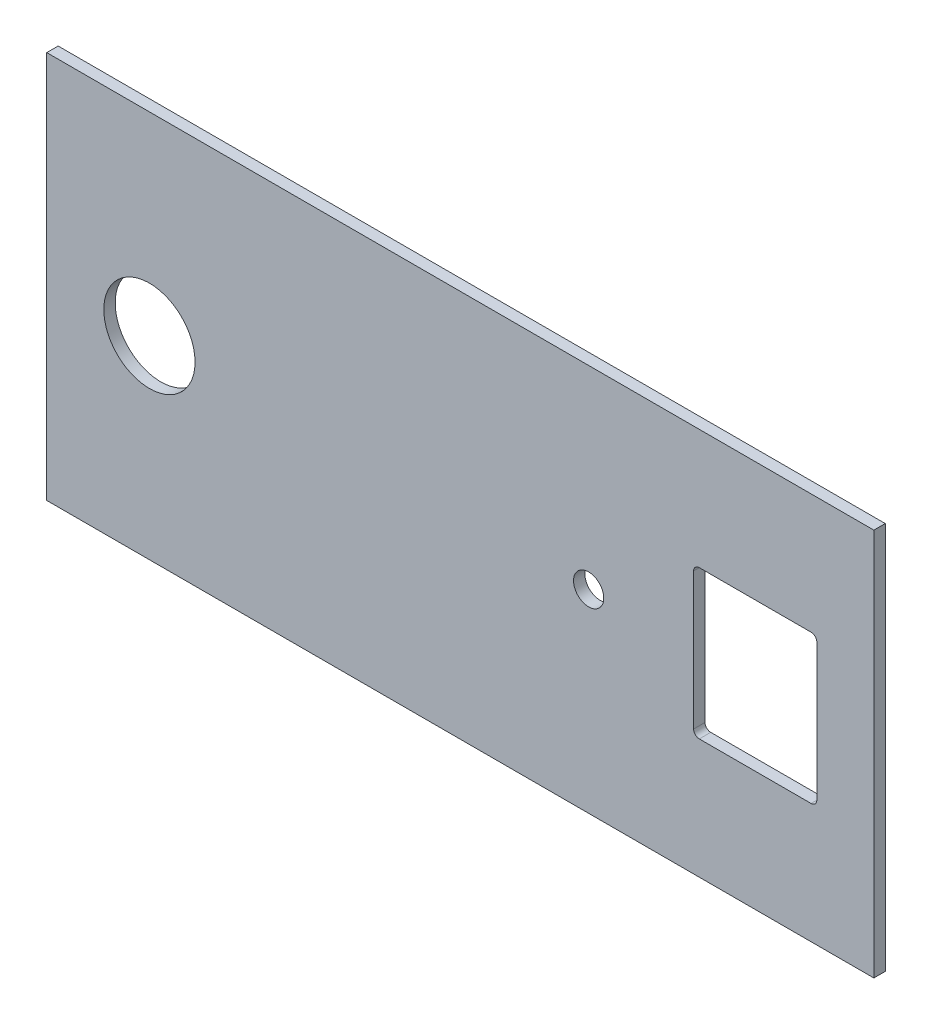
from build123d import *

# Parameters (mm, degrees)
SKETCH1_W           = 145
SKETCH1_H           = 68
BOSS_EXTRUDE1_DEPTH = 2
SKETCH2_R           = 8
SKETCH2_R_2         = 2.65
CUT_EXTRUDE1_DEPTH  = 81.101498113


with BuildPart() as part:
    # Sketch1 → Boss-Extrude1 (new body)
    with BuildSketch(Plane.XY):
        Rectangle(SKETCH1_W, SKETCH1_H)
    extrude(amount=BOSS_EXTRUDE1_DEPTH)

    # Sketch2 → Cut-Extrude1 (cut, through all)
    with BuildSketch(Plane.XY.offset(2)):
        with Locations((-54.5, 0)):
            Circle(SKETCH2_R)
        with Locations((22.5, 0)):
            Circle(SKETCH2_R_2)
        with BuildLine():
            Line((61.5, -13), (41.9, -13))
            ThreePointArc((41.9, -13), (41.192893219, -12.707106781), (40.9, -12))
            Line((40.9, -12), (40.9, 12))
            ThreePointArc((40.9, 12), (41.192893219, 12.707106781), (41.9, 13))
            Line((41.9, 13), (61.5, 13))
            ThreePointArc((61.5, 13), (62.207106781, 12.707106781), (62.5, 12))
            Line((62.5, 12), (62.5, -12))
            ThreePointArc((62.5, -12), (62.207106781, -12.707106781), (61.5, -13))
        make_face()
    extrude(amount=-CUT_EXTRUDE1_DEPTH, mode=Mode.SUBTRACT)


solid = part.part
